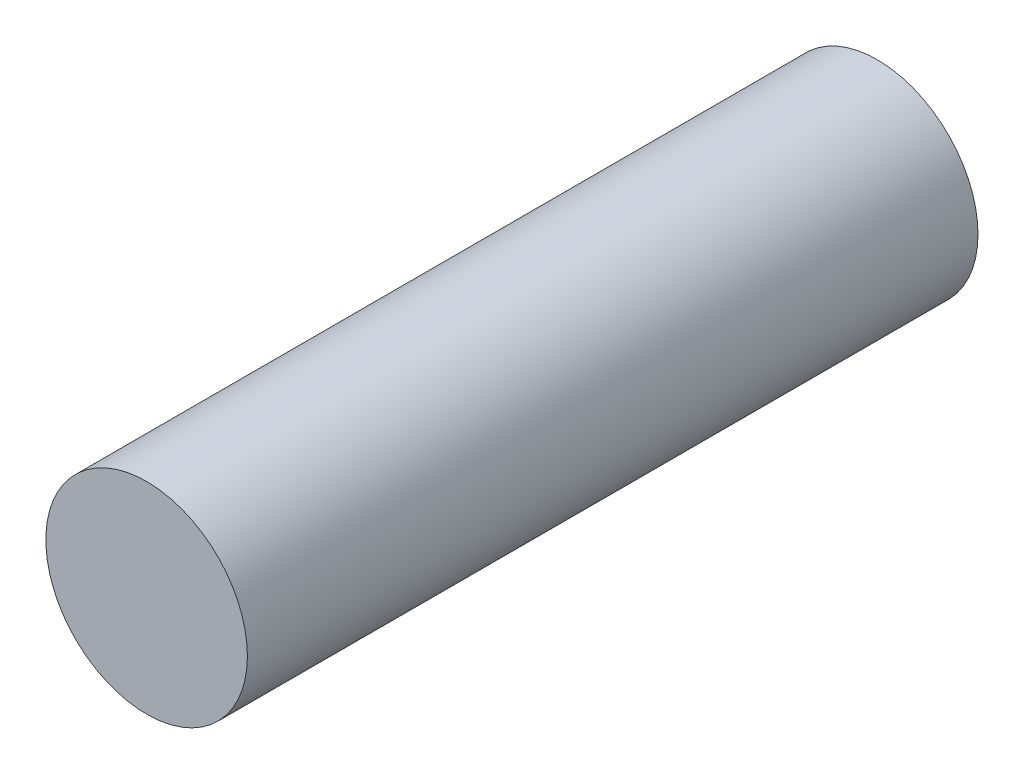
from build123d import *

# Parameters (mm, degrees)
ESQUISSE1_R        = 4
BOSS_EXTRU_1_DEPTH = 29


with BuildPart() as part:
    # Esquisse1 → Boss.-Extru.1 (new body)
    with BuildSketch(Plane.XY):
        Circle(ESQUISSE1_R)
    extrude(amount=BOSS_EXTRU_1_DEPTH)


solid = part.part
